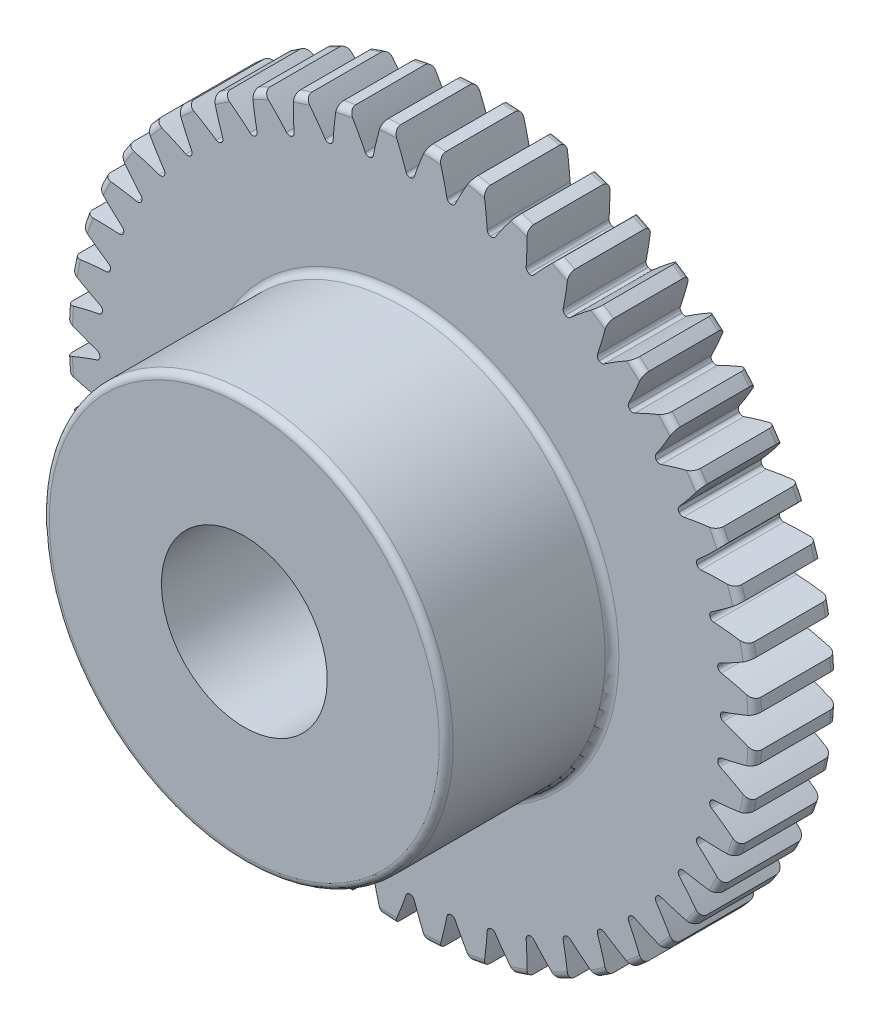
from build123d import *

# Parameters (mm, degrees)
FILLET2_R          = 0.26416
CUT_EXTRUDE2_DEPTH = 20.728786852
CIRPATTERN1_COUNT  = 48


with BuildPart() as part:
    # Sketch4 → Revolve1 (revolve)
    with BuildSketch(Plane(origin=(0, 0, 0), x_dir=(0, 0, -1), z_dir=(1, 0, 0))):
        Polygon((-9.525, 3.175), (-9.525, 7.7343), (-3.175, 7.7343), (-3.175, 13.208), (0, 13.208), (0, 3.175), align=None)
    revolve(axis=Axis((0, 0, 3.175), (0, 0, 1)))

    # Fillet2
    fillet2_edges = [part.edges().sort_by_distance(p)[0] for p in [
        (0, -13.208, 0),
        (0, -13.208, 3.175),
        (0, -7.7343, 3.175),
        (0, -7.7343, 9.525),
    ]]
    fillet(fillet2_edges, radius=FILLET2_R)

    # Sketch7 → Cut-Extrude2 (cut, through all)
    with BuildSketch(Plane.XY.offset(3.175)):
        with BuildLine():
            ThreePointArc((-0.007519853, 11.885080954), (0, 11.885083333), (0.007519853, 11.885080954))
            ThreePointArc((0.007519853, 11.885080954), (0.100323772, 11.914957651), (0.158168143, 11.993438305))
            ThreePointArc((0.158168143, 11.993438305), (0.37822747, 12.599204555), (0.628734928, 13.193026809))
            ThreePointArc((0.628734928, 13.193026809), (0, 13.208), (-0.628734928, 13.193026809))
            ThreePointArc((-0.628734928, 13.193026809), (-0.37822747, 12.599204555), (-0.158168143, 11.993438305))
            ThreePointArc((-0.158168143, 11.993438305), (-0.100323772, 11.914957651), (-0.007519853, 11.885080954))
        make_face()
    cut_extrude2 = extrude(amount=-CUT_EXTRUDE2_DEPTH, mode=Mode.SUBTRACT)

    # CirPattern1: Cut-Extrude2 ×48 about axis
    cirpattern1_axis = Axis((0, 0, 0), (0, 0, 1))
    for i in range(1, CIRPATTERN1_COUNT):
        add(cut_extrude2.rotate(cirpattern1_axis, i * 360 / CIRPATTERN1_COUNT), mode=Mode.SUBTRACT)


solid = part.part
